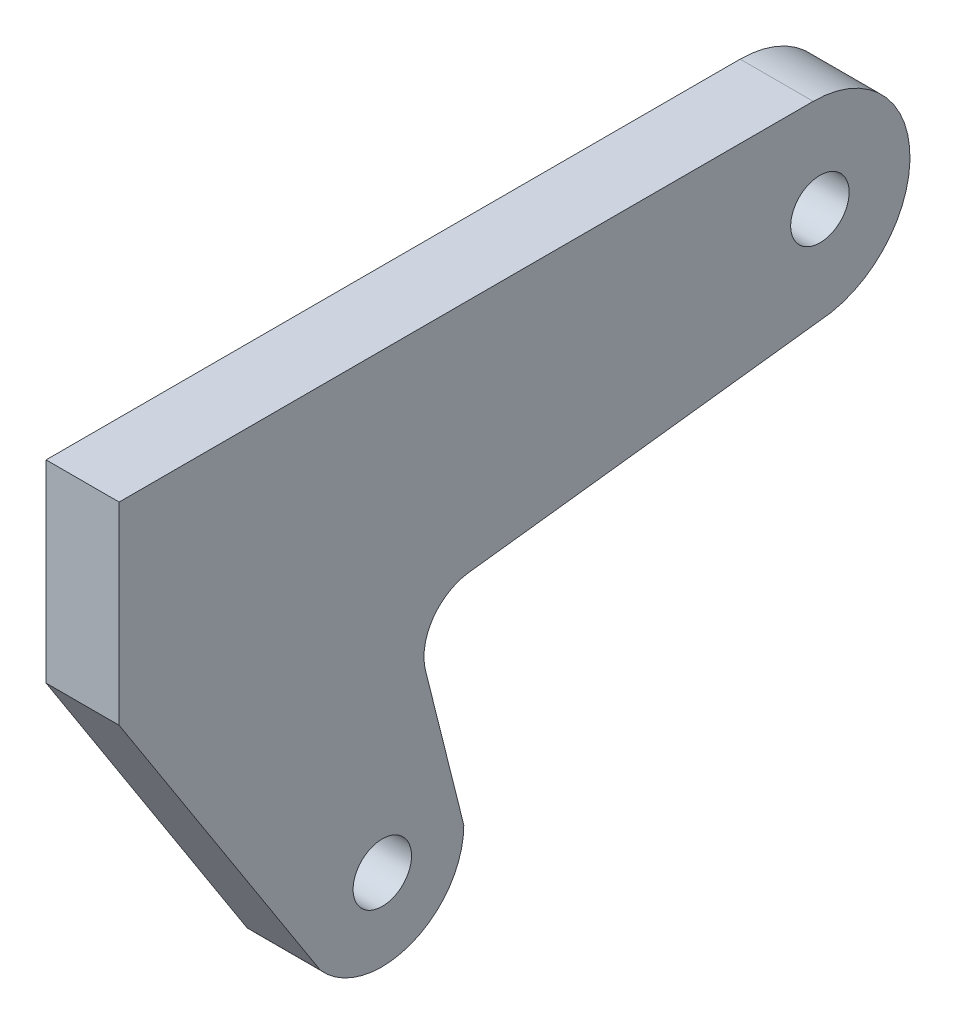
from build123d import *

# Parameters (mm, degrees)
EXTRUDE_1_DEPTH     = 10
SKETCH_2_R          = 4
CUT_EXTRUDE_1_DEPTH = 131.970599025


with BuildPart() as part:
    # Эскиз1 → Вытянуть1 (new body)
    with BuildSketch(Plane(origin=(0, 0, 0), x_dir=(0, 0, -1), z_dir=(1, 0, 0))):
        with BuildLine():
            Line((0, 0), (0, -26.457513111))
            Line((0, -26.457513111), (27.520390874, -69.232651823))
            ThreePointArc((27.520390874, -69.232651823), (39.895894439, -72.361692048), (47.168175164, -61.870842975))
            Line((47.168175164, -61.870842975), (41.925259283, -40.921571184))
            ThreePointArc((41.925259283, -40.921571184), (42.947914526, -35.255861998), (47.872279974, -32.273126802))
            Line((47.872279974, -32.273126802), (95.780101016, -26.457513111))
            ThreePointArc((95.780101016, -26.457513111), (108.222992472, -12.84453329), (94.988313332, 0))
            Line((94.988313332, 0), (0, 0))
        make_face()
    extrude(amount=EXTRUDE_1_DEPTH)

    # Эскиз2 → Вырез-Вытянуть1 (cut, through all)
    with BuildSketch(Plane(origin=(10, 0, 0), x_dir=(0, 0, -1), z_dir=(1, 0, 0))):
        with Locations((95.904397826, -13.228756555)):
            Circle(SKETCH_2_R)
        with Locations((36.015412993, -61.926732738)):
            Circle(SKETCH_2_R)
    extrude(amount=-CUT_EXTRUDE_1_DEPTH, mode=Mode.SUBTRACT)


solid = part.part
